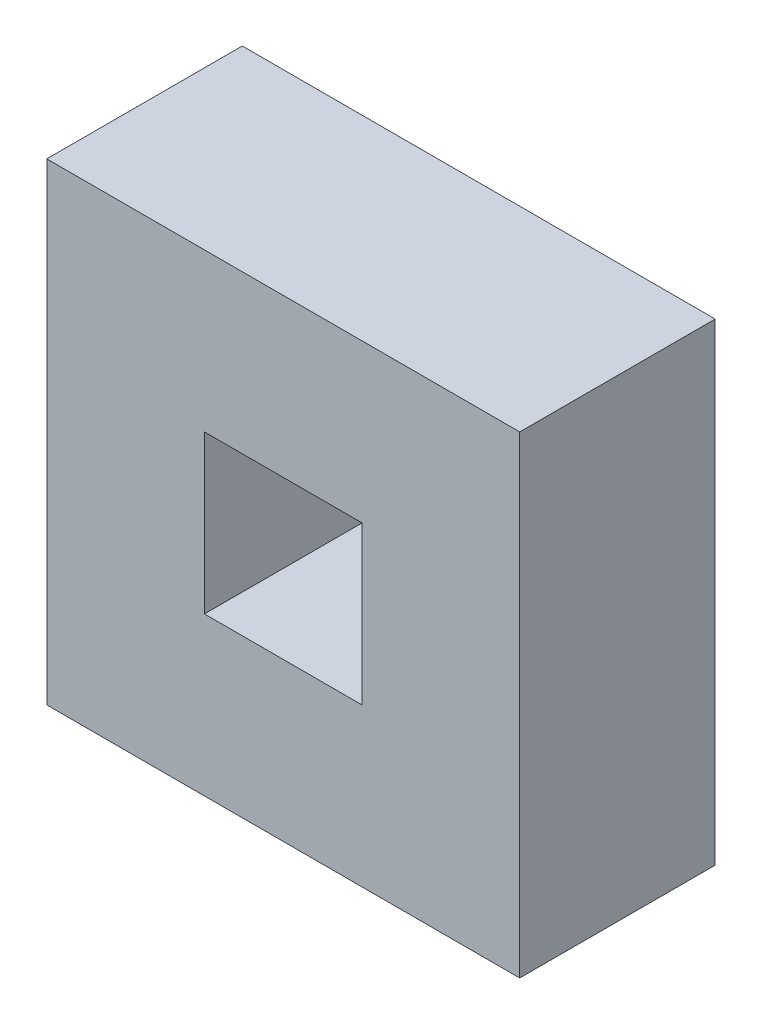
from build123d import *

# Parameters (mm, degrees)
SKETCH1_W           = 30
SKETCH1_H           = 30
SKETCH1_W_2         = 10
SKETCH1_H_2         = 10
BOSS_EXTRUDE1_DEPTH = 12.4


with BuildPart() as part:
    # Sketch1 → Boss-Extrude1 (new body)
    with BuildSketch(Plane.XY):
        with Locations((15, 15)):
            Rectangle(SKETCH1_W, SKETCH1_H)
        with Locations((15, 15)):
            Rectangle(SKETCH1_W_2, SKETCH1_H_2, mode=Mode.SUBTRACT)
    extrude(amount=BOSS_EXTRUDE1_DEPTH)


solid = part.part
